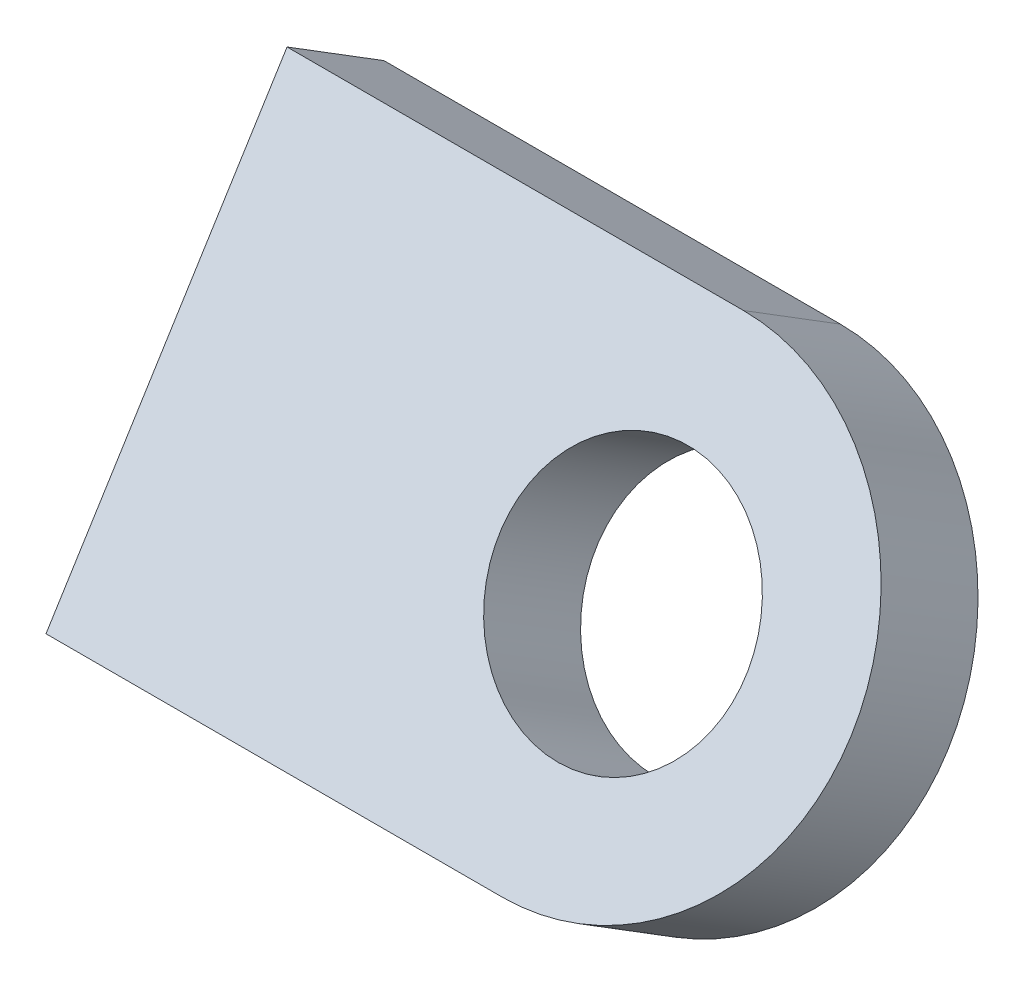
from build123d import *

# Parameters (mm, degrees)
SKETCH1_R           = 3.429
BOSS_EXTRUDE1_DEPTH = 3.175


with BuildPart() as part:
    # Sketch1 → Boss-Extrude1 (new body)
    with BuildSketch(Plane(origin=(0, 57.748228162, 92.87630262), x_dir=(1, 0, 0), z_dir=(8.275595139596941e-15, 0.5280284968261333, 0.84922665204263))):
        with BuildLine():
            Line((-316.811740451, 45.192795345), (-304.111740451, 45.192795345))
            ThreePointArc((-304.111740451, 45.192795345), (-297.761740451, 38.842795345), (-304.111740451, 32.492795345))
            Line((-304.111740451, 32.492795345), (-316.811740451, 32.492795345))
            Line((-316.811740451, 32.492795345), (-316.811740451, 45.192795345))
        make_face()
        with Locations(Location((-304.111740451, 38.842795345, 0), (0, 0, 270))):
            Circle(SKETCH1_R, mode=Mode.SUBTRACT)
    extrude(amount=BOSS_EXTRUDE1_DEPTH)


solid = part.part
